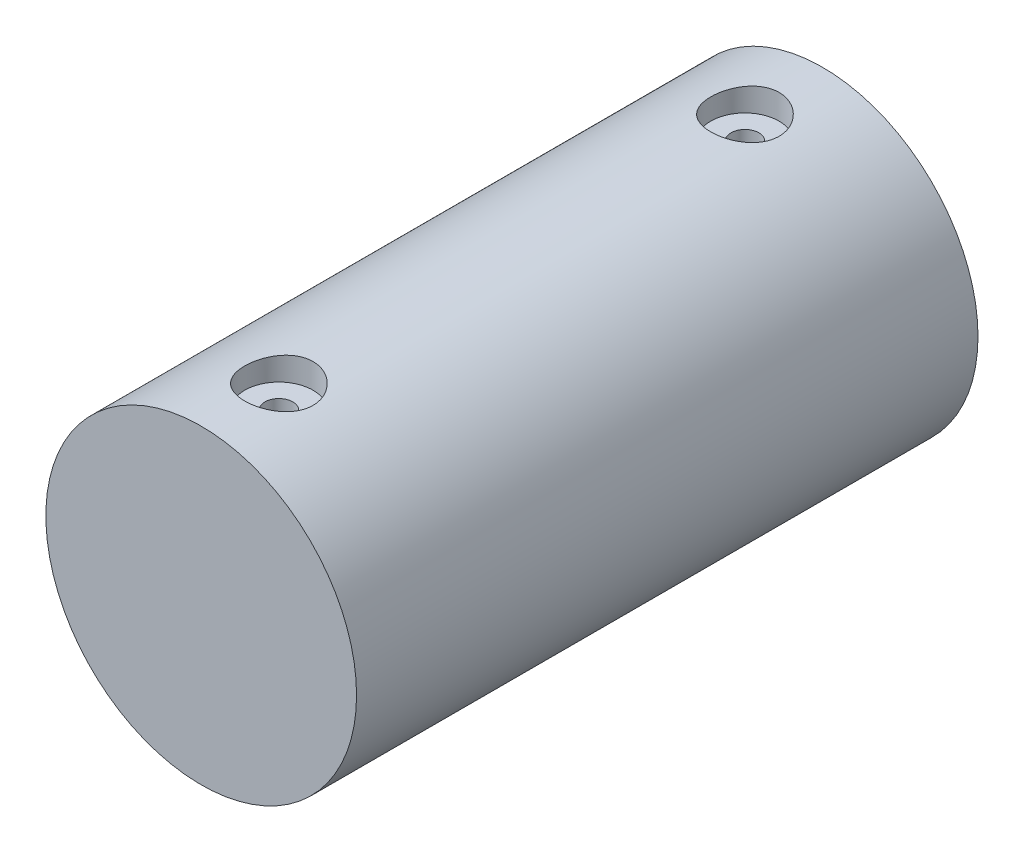
from build123d import *

# Parameters (mm, degrees)
SKIZZE1_R                                           = 50
AUFSATZ_LINEAR_AUSTRAGEN1_DEPTH                     = 200
STIRNSENKUNG_F_R_M8_SENKSCHRAUBE_KOPF_B_D           = 9
STIRNSENKUNG_F_R_M8_SENKSCHRAUBE_KOPF_B_CBORE_D     = 22
STIRNSENKUNG_F_R_M8_SENKSCHRAUBE_KOPF_B_CBORE_DEPTH = 8
STIRNSENKUNG_F_R_M8_SENKSCHRAUBE_KO_2_D             = 9
STIRNSENKUNG_F_R_M8_SENKSCHRAUBE_KO_2_CBORE_D       = 15
STIRNSENKUNG_F_R_M8_SENKSCHRAUBE_KO_2_CBORE_DEPTH   = 8


with BuildPart() as part:
    # Skizze1 → Aufsatz-Linear austragen1 (new body)
    with BuildSketch(Plane.XY):
        Circle(SKIZZE1_R)
    extrude(amount=AUFSATZ_LINEAR_AUSTRAGEN1_DEPTH)

    # Stirnsenkung f_r M8 Senkschraube _Kopf B (through all)
    with Locations(Plane(origin=(0, 50, 0), x_dir=(1, 0, 0), z_dir=(0, 1, 0))):
        with Locations((0, -25), (0, -175)):
            CounterBoreHole(STIRNSENKUNG_F_R_M8_SENKSCHRAUBE_KOPF_B_D / 2, STIRNSENKUNG_F_R_M8_SENKSCHRAUBE_KOPF_B_CBORE_D / 2, STIRNSENKUNG_F_R_M8_SENKSCHRAUBE_KOPF_B_CBORE_DEPTH)

    # Stirnsenkung f_r M8 Senkschraube _Ko 2 (through all)
    with Locations(Plane(origin=(0, -50, 0), x_dir=(-1, 0, 0), z_dir=(0, -1, 0))):
        with Locations((0, -175), (0, -25)):
            CounterBoreHole(STIRNSENKUNG_F_R_M8_SENKSCHRAUBE_KO_2_D / 2, STIRNSENKUNG_F_R_M8_SENKSCHRAUBE_KO_2_CBORE_D / 2, STIRNSENKUNG_F_R_M8_SENKSCHRAUBE_KO_2_CBORE_DEPTH)


solid = part.part
